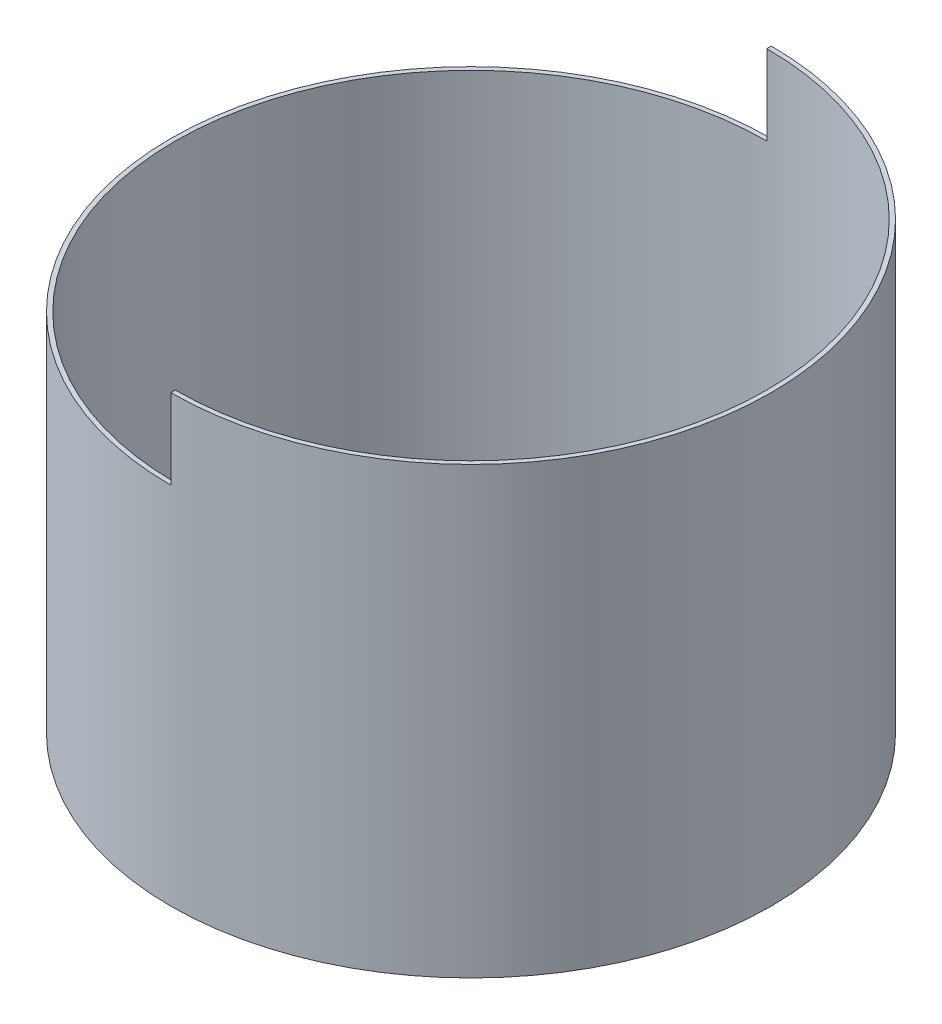
from build123d import *

# Parameters (mm, degrees)
SKETCH_1_R          = 67.5
SKETCH_1_R_2        = 66.5
EXTRUDE_1_DEPTH     = 100
SKETCH_2_W          = 67.5
SKETCH_2_H          = 135
CUT_EXTRUDE_1_DEPTH = 18


with BuildPart() as part:
    # 草图1 → 凸台-拉伸1 (new body)
    with BuildSketch(Plane(origin=(0, 0, 0), x_dir=(1, 0, 0), z_dir=(0, 1, 0))):
        with Locations(Location((0, 0, 0), (0, 0, 270))):
            Circle(SKETCH_1_R)
        with Locations(Location((0, 0, 0), (0, 0, 270))):
            Circle(SKETCH_1_R_2, mode=Mode.SUBTRACT)
    extrude(amount=EXTRUDE_1_DEPTH)

    # 草图2 → 切除-拉伸1 (cut)
    with BuildSketch(Plane(origin=(0, 100, 0), x_dir=(1, 0, 0), z_dir=(0, 1, 0))):
        with Locations((-33.75, 0)):
            Rectangle(SKETCH_2_W, SKETCH_2_H)
    extrude(amount=-CUT_EXTRUDE_1_DEPTH, mode=Mode.SUBTRACT)


solid = part.part
